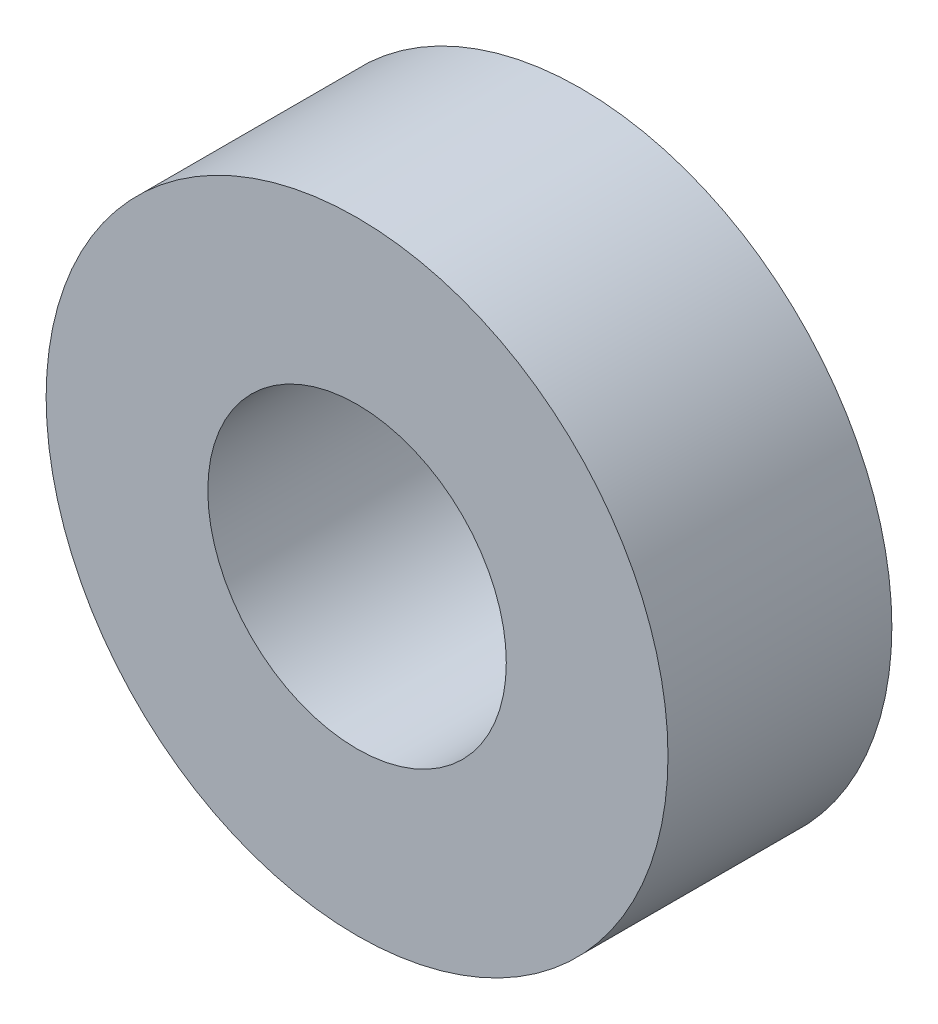
from build123d import *

# Parameters (mm, degrees)
BASES_R    = 6.25
BASES_R_2  = 3
BASE_DEPTH = 4.5


with BuildPart() as part:
    # BaseS → BASE (new body)
    with BuildSketch(Plane.XY):
        Circle(BASES_R)
        Circle(BASES_R_2, mode=Mode.SUBTRACT)
    extrude(amount=BASE_DEPTH)


solid = part.part
